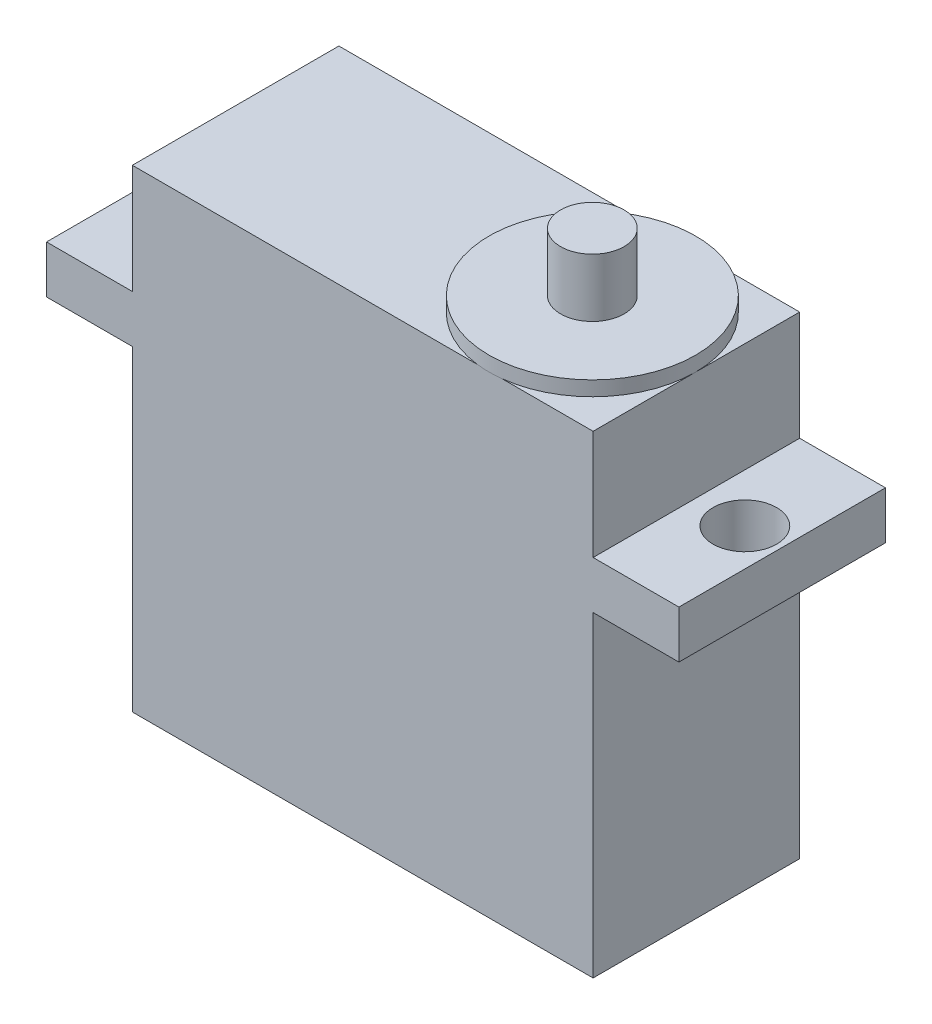
from build123d import *

# Parameters (mm, degrees)
SKETCH1_W           = 29
SKETCH1_H           = 13
BOSS_EXTRUDE1_DEPTH = 19.92
SKETCH2_W           = 39.8
SKETCH2_H           = 13
SKETCH2_R           = 2
BOSS_EXTRUDE2_DEPTH = 3
SKETCH3_W           = 29
SKETCH3_H           = 13
BOSS_EXTRUDE3_DEPTH = 6.88
SKETCH4_R           = 6.5
BOSS_EXTRUDE4_DEPTH = 0.92
SKETCH5_R           = 2
BOSS_EXTRUDE5_DEPTH = 3.67


with BuildPart() as part:
    # Sketch1 → Boss-Extrude1 (new body)
    with BuildSketch(Plane(origin=(0, 0, 0), x_dir=(1, 0, 0), z_dir=(0, 1, 0))):
        with Locations((14.5, 6.5)):
            Rectangle(SKETCH1_W, SKETCH1_H)
    extrude(amount=BOSS_EXTRUDE1_DEPTH)

    # Sketch2 → Boss-Extrude2 (add)
    with BuildSketch(Plane(origin=(0, 19.92, 0), x_dir=(1, 0, 0), z_dir=(0, 1, 0))):
        with Locations((14.5, 6.5)):
            Rectangle(SKETCH2_W, SKETCH2_H)
        with Locations(Location((-3.05, 6.5, 0), (0, 0, 270))):
            Circle(SKETCH2_R, mode=Mode.SUBTRACT)
        with Locations(Location((32.05, 6.5, 0), (0, 0, 270))):
            Circle(SKETCH2_R, mode=Mode.SUBTRACT)
    extrude(amount=BOSS_EXTRUDE2_DEPTH)

    # Sketch3 → Boss-Extrude3 (add)
    with BuildSketch(Plane(origin=(0, 22.92, 0), x_dir=(1, 0, 0), z_dir=(0, 1, 0))):
        with Locations((14.5, 6.5)):
            Rectangle(SKETCH3_W, SKETCH3_H)
    extrude(amount=BOSS_EXTRUDE3_DEPTH)

    # Sketch4 → Boss-Extrude4 (add)
    with BuildSketch(Plane(origin=(0, 29.8, 0), x_dir=(1, 0, 0), z_dir=(0, 1, 0))):
        with Locations((22.5, 6.452760886)):
            Circle(SKETCH4_R)
    extrude(amount=BOSS_EXTRUDE4_DEPTH)

    # Sketch5 → Boss-Extrude5 (add)
    with BuildSketch(Plane(origin=(0, 30.72, 0), x_dir=(1, 0, 0), z_dir=(0, 1, 0))):
        with Locations(Location((22.5, 6.452760886, 0), (0, 0, 90))):
            Circle(SKETCH5_R)
    extrude(amount=BOSS_EXTRUDE5_DEPTH)


solid = part.part
